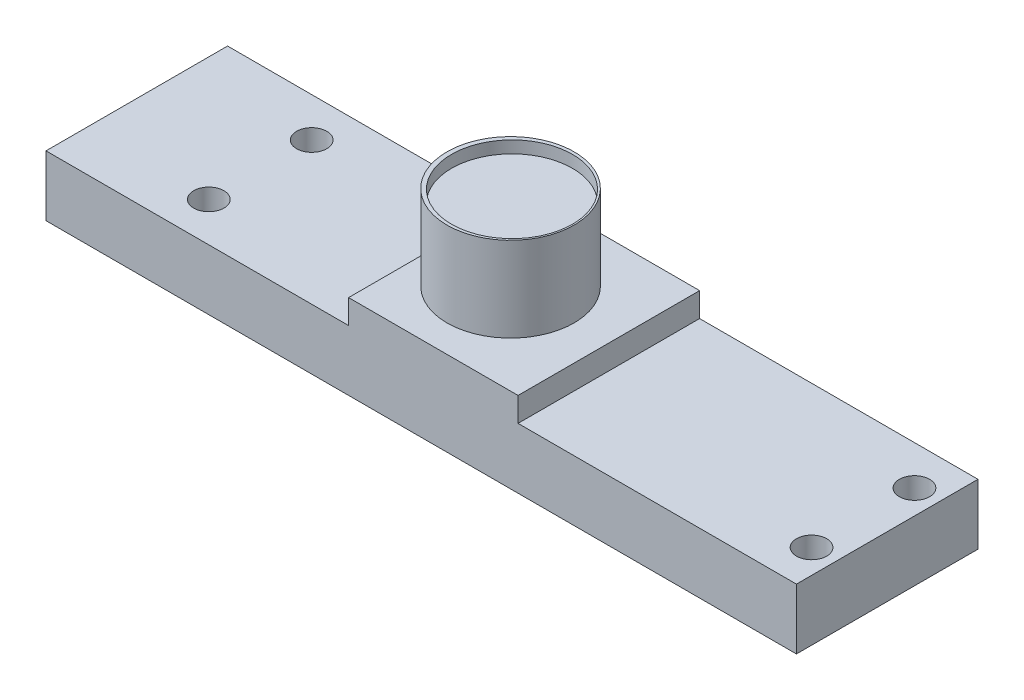
from build123d import *

# Parameters (mm, degrees)
SKETCH1_W           = 62
SKETCH1_H           = 15
SKETCH1_R           = 5.25
BOSS_EXTRUDE1_DEPTH = 5
SKETCH1_7_R         = 1.25
CUT_EXTRUDE1_DEPTH  = 5
SKETCH1_8_W         = 14
SKETCH1_8_H         = 15
BOSS_EXTRUDE2_DEPTH = 7
SKETCH1_9_R         = 5.25
BOSS_EXTRUDE3_DEPTH = 14
SKETCH2_R           = 5
CUT_EXTRUDE2_DEPTH  = 1
SKETCH3_W           = 12
SKETCH3_H           = 4.5
CUT_EXTRUDE4_DEPTH  = 8


with BuildPart() as part:
    # Sketch1 → Boss-Extrude1 (new body)
    with BuildSketch(Plane(origin=(0, 0, 0), x_dir=(1, 0, 0), z_dir=(0, 1, 0))):
        Rectangle(SKETCH1_W, SKETCH1_H)
        with Locations((-0.12, 0)):
            Circle(SKETCH1_R, mode=Mode.SUBTRACT)
    extrude(amount=BOSS_EXTRUDE1_DEPTH)

    # Sketch1<7> → Cut-Extrude1 (cut)
    with BuildSketch(Plane(origin=(0, 0, 0), x_dir=(1, 0, 0), z_dir=(0, 1, 0))):
        with Locations((29, 4.25)):
            Circle(SKETCH1_7_R)
        with Locations((29, -4.25)):
            Circle(SKETCH1_7_R)
        with Locations((-20.8, 4.25)):
            Circle(SKETCH1_7_R)
        with Locations((-20.8, -4.25)):
            Circle(SKETCH1_7_R)
    extrude(amount=CUT_EXTRUDE1_DEPTH, mode=Mode.SUBTRACT)

    # Sketch1<8> → Boss-Extrude2 (add)
    with BuildSketch(Plane(origin=(0, 0, 0), x_dir=(1, 0, 0), z_dir=(0, 1, 0))):
        with Locations((1, 0)):
            Rectangle(SKETCH1_8_W, SKETCH1_8_H)
    extrude(amount=BOSS_EXTRUDE2_DEPTH)

    # Sketch1<9> → Boss-Extrude3 (add)
    with BuildSketch(Plane(origin=(0, 0, 0), x_dir=(1, 0, 0), z_dir=(0, 1, 0))):
        with Locations((-0.12, 0)):
            Circle(SKETCH1_9_R)
    extrude(amount=BOSS_EXTRUDE3_DEPTH)

    # Sketch2 → Cut-Extrude2 (cut)
    with BuildSketch(Plane(origin=(0, 14, 0), x_dir=(1, 0, 0), z_dir=(0, 1, 0))):
        Circle(SKETCH2_R)
    extrude(amount=-CUT_EXTRUDE2_DEPTH, mode=Mode.SUBTRACT)

    # Sketch3 → Cut-Extrude4 (cut)
    with BuildSketch(Plane.ZY.offset(31)):
        with Locations((0, 2.5)):
            Rectangle(SKETCH3_W, SKETCH3_H)
    extrude(amount=-CUT_EXTRUDE4_DEPTH, mode=Mode.SUBTRACT)


solid = part.part
